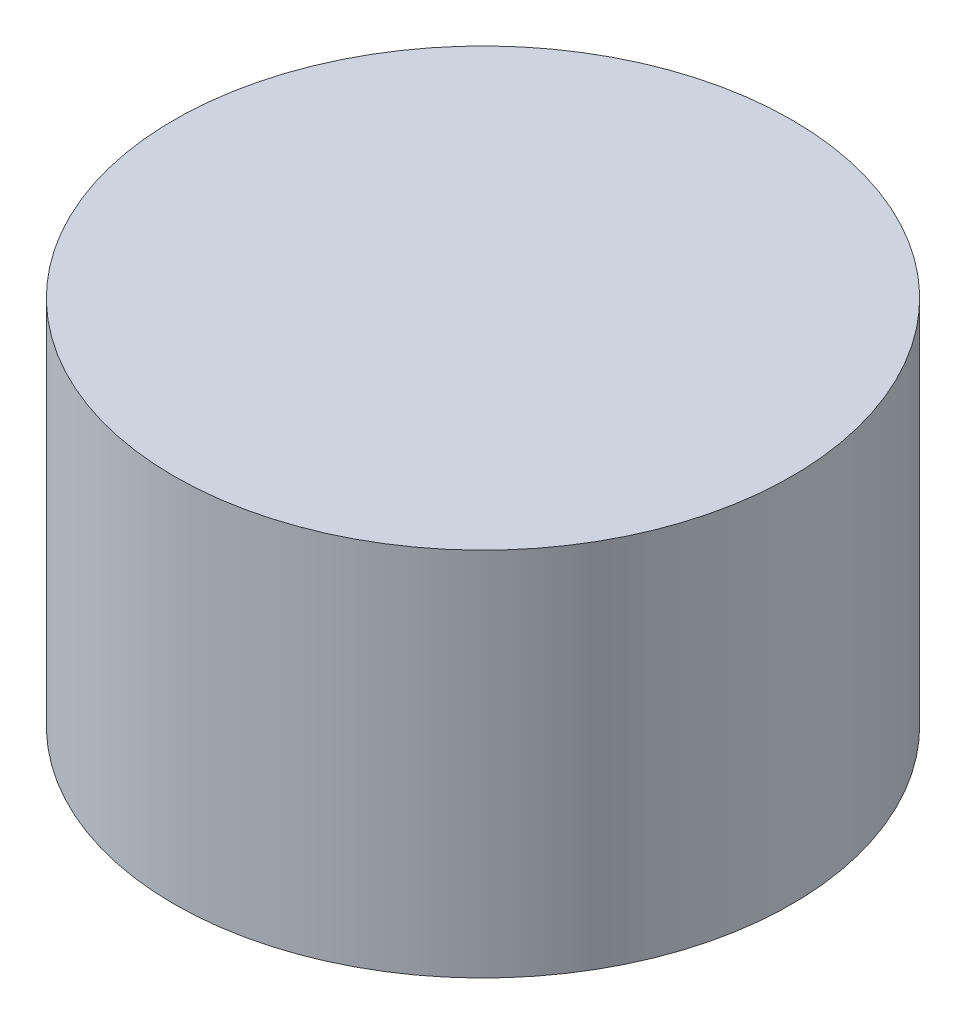
from build123d import *

# Parameters (mm, degrees)
SKETCH1_R           = 2.5
BOSS_EXTRUDE1_DEPTH = 3


with BuildPart() as part:
    # Sketch1 → Boss-Extrude1 (new body)
    with BuildSketch(Plane(origin=(0, 0, 0), x_dir=(1, 0, 0), z_dir=(0, 1, 0))):
        with Locations(Location((0, 0, 0), (0, 0, 270))):
            Circle(SKETCH1_R)
    extrude(amount=BOSS_EXTRUDE1_DEPTH)


solid = part.part
